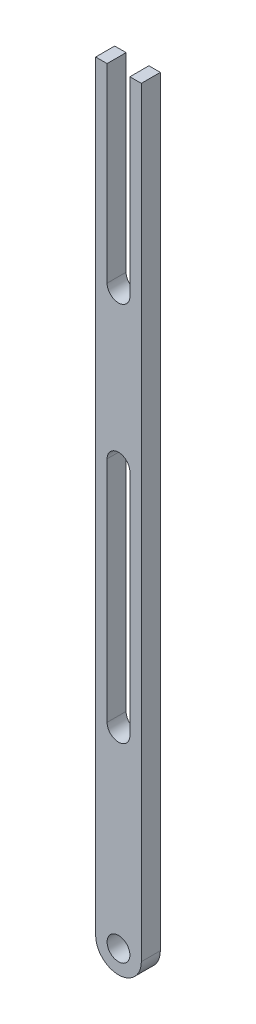
from build123d import *

# Parameters (mm, degrees)
BOSS_EXTRUDE1_DEPTH = 5
SKETCH2_R           = 3
CUT_EXTRUDE1_DEPTH  = 5
CUT_EXTRUDE2_DEPTH  = 5
CUT_EXTRUDE7_DEPTH  = 5


with BuildPart() as part:
    # Sketch1 → Boss-Extrude1 (new body)
    with BuildSketch(Plane.XY):
        with BuildLine():
            Line((-0.6, -8), (-0.6, 192))
            Line((-0.6, 192), (11.4, 192))
            Line((11.4, 192), (11.4, -8))
            ThreePointArc((11.4, -8), (5.4, -14), (-0.6, -8))
        make_face()
    extrude(amount=BOSS_EXTRUDE1_DEPTH)

    # Sketch2 → Cut-Extrude1 (cut)
    with BuildSketch(Plane.XY.offset(5)):
        with Locations((5.4, -8)):
            Circle(SKETCH2_R)
    extrude(amount=-CUT_EXTRUDE1_DEPTH, mode=Mode.SUBTRACT)

    # Sketch4 → Cut-Extrude2 (cut)
    with BuildSketch(Plane.XY.offset(5)):
        with BuildLine():
            Line((2.4, 102), (2.4, 42))
            ThreePointArc((2.4, 42), (5.4, 39), (8.4, 42))
            Line((8.4, 42), (8.4, 102))
            ThreePointArc((8.4, 102), (5.4, 105), (2.4, 102))
        make_face()
    extrude(amount=-CUT_EXTRUDE2_DEPTH, mode=Mode.SUBTRACT)

    # Sketch5 → Cut-Extrude7 (cut)
    with BuildSketch(Plane.XY.offset(5)):
        with BuildLine():
            Line((2.4, 192), (2.4, 142))
            ThreePointArc((2.4, 142), (5.4, 139), (8.4, 142))
            Line((8.4, 142), (8.4, 192))
            Line((8.4, 192), (2.4, 192))
        make_face()
    extrude(amount=-CUT_EXTRUDE7_DEPTH, mode=Mode.SUBTRACT)


solid = part.part
